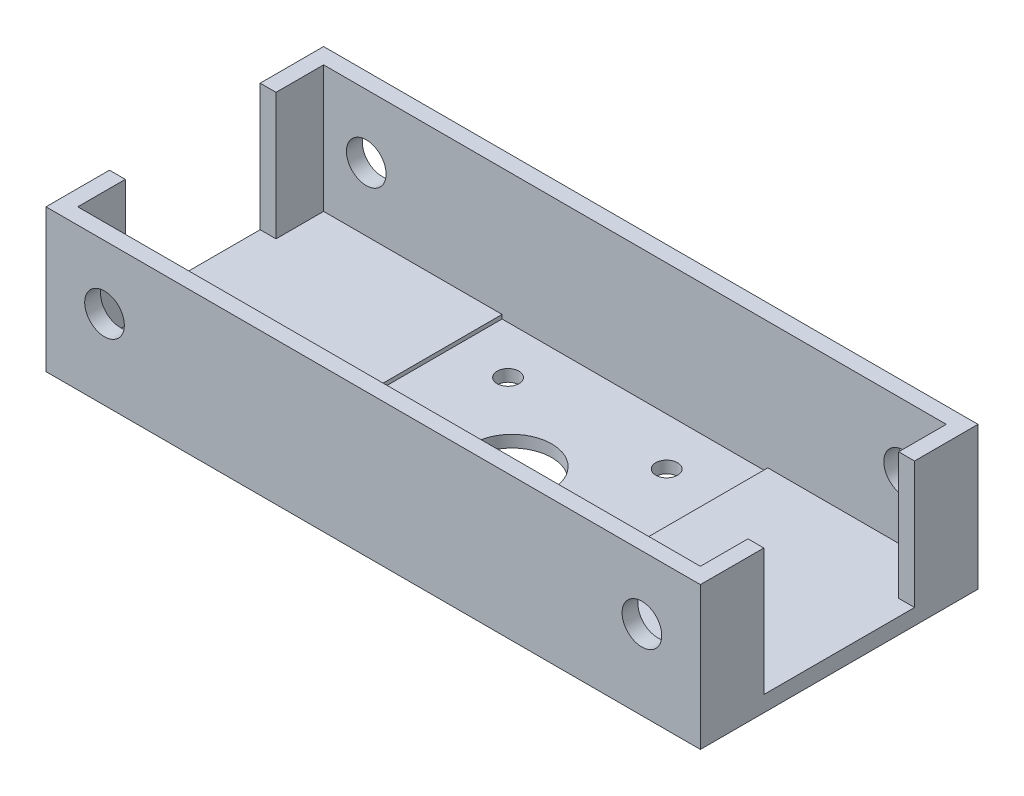
from build123d import *

# Parameters (mm, degrees)
SKETCH1_W                 = 75
SKETCH1_H                 = 40
SKETCH1_R                 = 5
SKETCH1_R_2               = 1.7
SKETCH1_W_2               = 10
SKETCH1_H_2               = 20
BOSS_EXTRUDE1_DEPTH       = 3
CUT_EXTRUDE1_DEPTH        = 43.605750786
CUT_EXTRUDE1_DEPTH_BACK   = 43.605750786
SKETCH2_W                 = 67
SKETCH2_H                 = 28
BOSS_EXTRUDE3_DEPTH       = 110
BOSS_EXTRUDE3_DEPTH_BACK  = 3
SKETCH6_W                 = 67
SKETCH6_H                 = 11
CUT_EXTRUDE4_DEPTH        = 122.372360939
SKETCH7_W                 = 70
SKETCH7_H                 = 37
BOSS_EXTRUDE4_DEPTH       = 45
SKETCH8_W                 = 45
SKETCH8_H                 = 62
CUT_EXTRUDE6_DEPTH        = 29
SKETCH11_W                = 45
SKETCH11_H                = 4
CUT_EXTRUDE9_DEPTH        = 157.445677473
SKETCH9_W                 = 38
SKETCH9_H                 = 28.5
CUT_EXTRUDE10_DEPTH       = 204.024629048
SKETCH13_W                = 5
SKETCH13_H                = 38
BOSS_EXTRUDE5_DEPTH       = 32
SKETCH14_R                = 5
SKETCH14_R_2              = 1.7
CUT_EXTRUDE11_DEPTH       = 32
SKETCH15_W                = 165
SKETCH15_H                = 70
SKETCH15_W_2              = 157
SKETCH15_H_2              = 62
BOSS_EXTRUDE6_DEPTH       = 3
SKETCH16_W                = 20
SKETCH16_H                = 4.820648258
CUT_EXTRUDE12_DEPTH       = 159.626132778
SKETCH18_R                = 5
CUT_EXTRUDE14_DEPTH       = 159.626132778
MIRROR6_COPY_1_SKETCH_W   = 5
MIRROR6_COPY_1_SKETCH_H   = 38
MIRROR6_COPY_1_DEPTH      = 32
MIRROR6_COPY_2_SKETCH_R   = 5
MIRROR6_COPY_2_SKETCH_R_2 = 1.7
MIRROR6_COPY_2_DEPTH      = 32
SKETCH19_W                = 38
SKETCH19_H                = 3.5
CUT_EXTRUDE15_DEPTH       = 10
SKETCH20_R                = 1.2
CUT_EXTRUDE16_DEPTH       = 10
SKETCH21_W                = 10
SKETCH21_H                = 80
CUT_EXTRUDE17_DEPTH       = 184.330984833
SKETCH22_W                = 55
SKETCH22_H                = 80
CUT_EXTRUDE18_DEPTH       = 184.330984833
SKETCH23_W                = 67
SKETCH23_H                = 62
BOSS_EXTRUDE7_DEPTH       = 3
SKETCH24_R                = 10
SKETCH24_R_2              = 2.75
CUT_EXTRUDE19_DEPTH       = 111.707949127
SKETCH25_W                = 38
SKETCH25_H                = 64
CUT_EXTRUDE20_DEPTH       = 115


with BuildPart() as part:
    # Sketch1 → Boss-Extrude1 (new body)
    with BuildSketch(Plane(origin=(0, 0, 0), x_dir=(1, 0, 0), z_dir=(0, 1, 0))):
        Rectangle(SKETCH1_W, SKETCH1_H)
        with Locations(Location((-21, 0, 0), (0, 0, 270))):
            Circle(SKETCH1_R, mode=Mode.SUBTRACT)
        with Locations(Location((-30, 8.25, 0), (0, 0, 270))):
            Circle(SKETCH1_R_2, mode=Mode.SUBTRACT)
        with Locations(Location((-12, 8.25, 0), (0, 0, 270))):
            Circle(SKETCH1_R_2, mode=Mode.SUBTRACT)
        with Locations(Location((-12, -8.25, 0), (0, 0, 270))):
            Circle(SKETCH1_R_2, mode=Mode.SUBTRACT)
        with Locations(Location((-30, -8.25, 0), (0, 0, 270))):
            Circle(SKETCH1_R_2, mode=Mode.SUBTRACT)
        with Locations(Location((12, 8.25, 0), (0, 0, 90))):
            Circle(SKETCH1_R_2, mode=Mode.SUBTRACT)
        with Locations(Location((12, -8.25, 0), (0, 0, 90))):
            Circle(SKETCH1_R_2, mode=Mode.SUBTRACT)
        with Locations(Location((21, 0, 0), (0, 0, 90))):
            Circle(SKETCH1_R, mode=Mode.SUBTRACT)
        with Locations(Location((30, -8.25, 0), (0, 0, 90))):
            Circle(SKETCH1_R_2, mode=Mode.SUBTRACT)
        with Locations(Location((30, 8.25, 0), (0, 0, 90))):
            Circle(SKETCH1_R_2, mode=Mode.SUBTRACT)
        Rectangle(SKETCH1_W_2, SKETCH1_H_2, mode=Mode.SUBTRACT)
    extrude(amount=BOSS_EXTRUDE1_DEPTH)

    # Sketch2 → Cut-Extrude1 (cut, two sides: drawn at the far end of the back side and taken through both)
    with BuildSketch(Plane(origin=(0, 3, 0), x_dir=(1, 0, 0), z_dir=(0, 1, 0)).offset(-CUT_EXTRUDE1_DEPTH_BACK)):
        Rectangle(SKETCH2_W, SKETCH2_H)
    extrude(amount=CUT_EXTRUDE1_DEPTH + CUT_EXTRUDE1_DEPTH_BACK, mode=Mode.SUBTRACT)

    # Sketch3 → Boss-Extrude3 (add, two sides: drawn at the far end of the back side and taken through both)
    with BuildSketch(Plane(origin=(0, 3, 0), x_dir=(1, 0, 0), z_dir=(0, 1, 0)).offset(-BOSS_EXTRUDE3_DEPTH_BACK)):
        Polygon((37.5, -35), (37.5, -20), (33.5, -20), (-33.5, -20), (-37.5, -20), (-37.5, -35), align=None)
        Polygon((33.5, 20), (37.5, 20), (37.5, 35), (-37.5, 35), (-37.5, 20), (-33.5, 20), align=None)
        Polygon((37.5, -20), (37.5, 20), (33.5, 20), (33.5, 14), (33.5, -14), (33.5, -20), align=None)
        Polygon((-33.5, 14), (-33.5, 20), (-37.5, 20), (-37.5, -20), (-33.5, -20), (-33.5, -14), align=None)
    extrude(amount=BOSS_EXTRUDE3_DEPTH + BOSS_EXTRUDE3_DEPTH_BACK)

    # Sketch6 → Cut-Extrude4 (cut, through all)
    with BuildSketch(Plane(origin=(0, 3, 0), x_dir=(1, 0, 0), z_dir=(0, 1, 0))):
        with Locations((0, -25.5)):
            Rectangle(SKETCH6_W, SKETCH6_H)
        with Locations((0, 25.5)):
            Rectangle(SKETCH6_W, SKETCH6_H)
    extrude(amount=CUT_EXTRUDE4_DEPTH, mode=Mode.SUBTRACT)

    # Sketch7 → Boss-Extrude4 (add)
    with BuildSketch(Plane.ZY.offset(37.5)):
        with Locations((0, 94.5)):
            Rectangle(SKETCH7_W, SKETCH7_H)
    boss_extrude4 = extrude(amount=BOSS_EXTRUDE4_DEPTH)

    # Mirror2: Boss-Extrude4 across plane
    add(boss_extrude4.mirror(Plane(origin=(0, 0, 0), x_dir=(0, 0, 1), z_dir=(1, 0, 0))))

    # Sketch8 → Cut-Extrude6 (cut)
    with BuildSketch(Plane(origin=(0, 113, 0), x_dir=(1, 0, 0), z_dir=(0, 1, 0))):
        with Locations((-56, 0)):
            Rectangle(SKETCH8_W, SKETCH8_H)
        with Locations((56, 0)):
            Rectangle(SKETCH8_W, SKETCH8_H)
    extrude(amount=-CUT_EXTRUDE6_DEPTH, mode=Mode.SUBTRACT)

    # Sketch11 → Cut-Extrude9 (cut, through all)
    with BuildSketch(Plane.XY.offset(35)):
        with Locations((-60, 78)):
            Rectangle(SKETCH11_W, SKETCH11_H)
        with Locations((60, 78)):
            Rectangle(SKETCH11_W, SKETCH11_H)
    extrude(amount=-CUT_EXTRUDE9_DEPTH, mode=Mode.SUBTRACT)

    # Sketch9 → Cut-Extrude10 (cut, through all)
    with BuildSketch(Plane.ZY.offset(82.5)):
        with Locations((0, 98.25)):
            Rectangle(SKETCH9_W, SKETCH9_H)
    extrude(amount=-CUT_EXTRUDE10_DEPTH, mode=Mode.SUBTRACT)

    # Sketch13 → Boss-Extrude5 (add)
    with BuildSketch(Plane(origin=(0, 84, 0), x_dir=(1, 0, 0), z_dir=(0, 1, 0))):
        with Locations((-54.5, 0)):
            Rectangle(SKETCH13_W, SKETCH13_H)
    boss_extrude5 = extrude(amount=BOSS_EXTRUDE5_DEPTH)

    # Sketch14 → Cut-Extrude11 (cut)
    with BuildSketch(Plane.ZY.offset(57)):
        with Locations((0, 98.25)):
            Circle(SKETCH14_R)
        with Locations((-9, 106.5)):
            Circle(SKETCH14_R_2)
        with Locations((9, 106.5)):
            Circle(SKETCH14_R_2)
        with Locations((9, 90)):
            Circle(SKETCH14_R_2)
        with Locations((-9, 90)):
            Circle(SKETCH14_R_2)
    cut_extrude11 = extrude(amount=-CUT_EXTRUDE11_DEPTH, mode=Mode.SUBTRACT)

    # Mirror4: Boss-Extrude5, Cut-Extrude11 across plane
    add(boss_extrude5.mirror(Plane(origin=(0, 0, 0), x_dir=(0, 0, 1), z_dir=(1, 0, 0))))
    add(cut_extrude11.mirror(Plane(origin=(0, 0, 0), x_dir=(0, 0, 1), z_dir=(1, 0, 0))), mode=Mode.SUBTRACT)

    # Sketch15 → Boss-Extrude6 (add)
    with BuildSketch(Plane(origin=(0, 113, 0), x_dir=(1, 0, 0), z_dir=(0, 1, 0))):
        Rectangle(SKETCH15_W, SKETCH15_H)
        Rectangle(SKETCH15_W_2, SKETCH15_H_2, mode=Mode.SUBTRACT)
    extrude(amount=BOSS_EXTRUDE6_DEPTH)

    # Sketch16 → Cut-Extrude12 (cut, through all)
    with BuildSketch(Plane.XY.offset(35)):
        with Locations((0, 11.636111214)):
            Rectangle(SKETCH16_W, SKETCH16_H)
    extrude(amount=-CUT_EXTRUDE12_DEPTH, mode=Mode.SUBTRACT)

    # Sketch18 → Cut-Extrude14 (cut, through all)
    with BuildSketch(Plane.XY.offset(35)):
        with Locations((67.75, 100)):
            Circle(SKETCH18_R)
    cut_extrude14 = extrude(amount=-CUT_EXTRUDE14_DEPTH, mode=Mode.SUBTRACT)

    # Mirror5: Cut-Extrude14 across plane
    add(cut_extrude14.mirror(Plane(origin=(0, 0, 0), x_dir=(0, 0, 1), z_dir=(1, 0, 0))), mode=Mode.SUBTRACT)

    # Mirror6: Boss-Extrude5, Cut-Extrude11 across plane
    add(boss_extrude5.mirror(Plane.ZX.offset(116)))
    add(cut_extrude11.mirror(Plane.ZX.offset(116)), mode=Mode.SUBTRACT)

    # Mirror6 copy 1 sketch → Mirror6 copy 1 (add)
    with BuildSketch(Plane(origin=(0, 148, 0), x_dir=(-1, 0, 0), z_dir=(0, -1, 0))):
        with Locations((-54.5, 0)):
            Rectangle(MIRROR6_COPY_1_SKETCH_W, MIRROR6_COPY_1_SKETCH_H)
    extrude(amount=MIRROR6_COPY_1_DEPTH)

    # Mirror6 copy 2 sketch → Mirror6 copy 2 (cut)
    with BuildSketch(Plane(origin=(57, 232, 0), x_dir=(0, 0, 1), z_dir=(1, 0, 0))):
        with Locations((0, 98.25)):
            Circle(MIRROR6_COPY_2_SKETCH_R)
        with Locations((-9, 106.5)):
            Circle(MIRROR6_COPY_2_SKETCH_R_2)
        with Locations((9, 106.5)):
            Circle(MIRROR6_COPY_2_SKETCH_R_2)
        with Locations((9, 90)):
            Circle(MIRROR6_COPY_2_SKETCH_R_2)
        with Locations((-9, 90)):
            Circle(MIRROR6_COPY_2_SKETCH_R_2)
    extrude(amount=-MIRROR6_COPY_2_DEPTH, mode=Mode.SUBTRACT)

    # Sketch19 → Cut-Extrude15 (cut)
    with BuildSketch(Plane(origin=(82.5, 0, 0), x_dir=(0, 0, -1), z_dir=(1, 0, 0))):
        with Locations((0, 114.25)):
            Rectangle(SKETCH19_W, SKETCH19_H)
    cut_extrude15 = extrude(amount=-CUT_EXTRUDE15_DEPTH, mode=Mode.SUBTRACT)

    # Mirror7: Cut-Extrude15 across plane
    add(cut_extrude15.mirror(Plane(origin=(0, 0, 0), x_dir=(0, 0, 1), z_dir=(1, 0, 0))), mode=Mode.SUBTRACT)

    # Sketch20 → Cut-Extrude16 (cut)
    with BuildSketch(Plane(origin=(0, 3, 0), x_dir=(1, 0, 0), z_dir=(0, 1, 0))):
        with Locations(Location((-24, 17.5, 0), (0, 0, 270))):
            Circle(SKETCH20_R)
        with Locations(Location((-12, 17.5, 0), (0, 0, 270))):
            Circle(SKETCH20_R)
        with Locations(Location((12, 17.5, 0), (0, 0, 270))):
            Circle(SKETCH20_R)
        with Locations(Location((-24, -17.5, 0), (0, 0, 270))):
            Circle(SKETCH20_R)
        with Locations(Location((-12, -17.5, 0), (0, 0, 270))):
            Circle(SKETCH20_R)
        with Locations(Location((24, 17.5, 0), (0, 0, 270))):
            Circle(SKETCH20_R)
        with Locations(Location((12, -17.5, 0), (0, 0, 270))):
            Circle(SKETCH20_R)
        with Locations(Location((24, -17.5, 0), (0, 0, 270))):
            Circle(SKETCH20_R)
    extrude(amount=-CUT_EXTRUDE16_DEPTH, mode=Mode.SUBTRACT)

    # Sketch21 → Cut-Extrude17 (cut, through all)
    with BuildSketch(Plane.XY.offset(35)):
        with Locations((32.5, 40)):
            Rectangle(SKETCH21_W, SKETCH21_H)
        with Locations((-32.5, 40)):
            Rectangle(SKETCH21_W, SKETCH21_H)
    extrude(amount=-CUT_EXTRUDE17_DEPTH, mode=Mode.SUBTRACT)

    # Sketch22 → Cut-Extrude18 (cut, through all)
    with BuildSketch(Plane.XY.offset(35)):
        with Locations((0, 40)):
            Rectangle(SKETCH22_W, SKETCH22_H)
    extrude(amount=-CUT_EXTRUDE18_DEPTH, mode=Mode.SUBTRACT)

    # Sketch23 → Boss-Extrude7 (add)
    with BuildSketch(Plane.XZ.offset(-80)):
        Rectangle(SKETCH23_W, SKETCH23_H)
    extrude(amount=-BOSS_EXTRUDE7_DEPTH)

    # Sketch24 → Cut-Extrude19 (cut, through all)
    with BuildSketch(Plane(origin=(0, 83, 0), x_dir=(1, 0, 0), z_dir=(0, 1, 0))):
        with Locations(Location((0, 0, 0), (0, 0, 270))):
            Circle(SKETCH24_R)
        with Locations(Location((-20, 19, 0), (0, 0, 270))):
            Circle(SKETCH24_R_2)
        with Locations(Location((-20, -19, 0), (0, 0, 270))):
            Circle(SKETCH24_R_2)
        with Locations(Location((20, -19, 0), (0, 0, 90))):
            Circle(SKETCH24_R_2)
        with Locations(Location((20, 19, 0), (0, 0, 90))):
            Circle(SKETCH24_R_2)
    extrude(amount=-CUT_EXTRUDE19_DEPTH, mode=Mode.SUBTRACT)

    # Sketch25 → Cut-Extrude20 (cut)
    with BuildSketch(Plane(origin=(57, 0, 0), x_dir=(0, 0, -1), z_dir=(1, 0, 0))):
        with Locations((0, 116)):
            Rectangle(SKETCH25_W, SKETCH25_H)
    extrude(amount=-CUT_EXTRUDE20_DEPTH, mode=Mode.SUBTRACT)


solid = part.part
